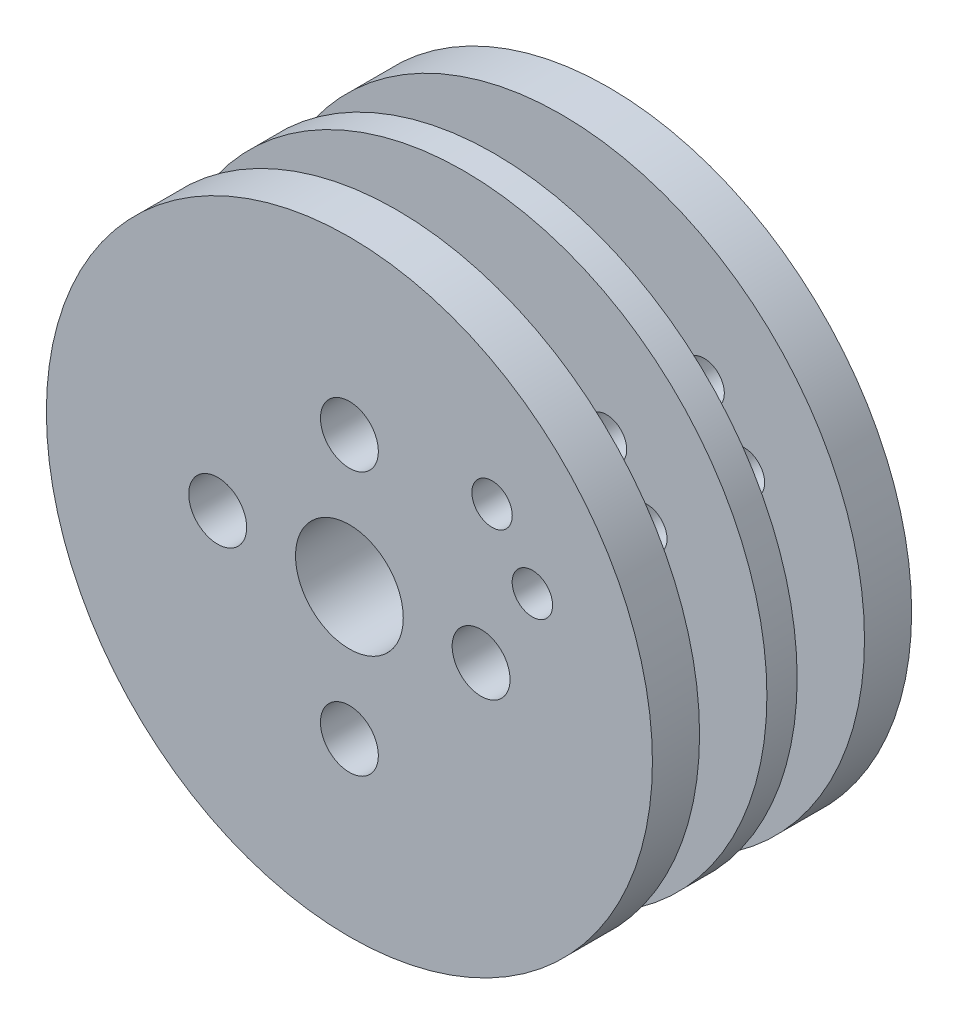
from build123d import *

# Parameters (mm, degrees)
SKETCH1_R           = 22.5
BOSS_EXTRUDE1_DEPTH = 2.24600008
SKETCH2_R           = 13
BOSS_EXTRUDE2_DEPTH = 5
BOSS_EXTRUDE4_START = 3.5
SKETCH5_R           = 22.5
BOSS_EXTRUDE4_DEPTH = 3.5
BOSS_EXTRUDE5_START = 5
SKETCH8_R           = 13
BOSS_EXTRUDE5_DEPTH = 5
SKETCH12_R          = 22.5
BOSS_EXTRUDE6_DEPTH = 3.5
SKETCH6_R           = 4
SKETCH6_R_2         = 2.15
SKETCH6_R_3         = 1.5
CUT_EXTRUDE1_DEPTH  = 38.187477988


with BuildPart() as part:
    # Sketch1 → Boss-Extrude1 (new body)
    with BuildSketch(Plane.XY):
        Circle(SKETCH1_R)
    extrude(amount=BOSS_EXTRUDE1_DEPTH)

    # Sketch2 → Boss-Extrude2 (add)
    with BuildSketch(Plane.XY):
        Circle(SKETCH2_R)
    extrude(amount=-BOSS_EXTRUDE2_DEPTH)

    # Sketch5 → Boss-Extrude4 (add)
    with BuildSketch(Plane(origin=(0, 0, -5), x_dir=(-1, 0, 0), z_dir=(0, 0, -1)).offset(BOSS_EXTRUDE4_START)):
        with Locations(Location((0, 0, 0), (0, 0, 180))):
            Circle(SKETCH5_R)
    extrude(amount=-BOSS_EXTRUDE4_DEPTH)

    # Sketch8 → Boss-Extrude5 (add)
    with BuildSketch(Plane.XY.offset(2.24600008).offset(BOSS_EXTRUDE5_START)):
        Circle(SKETCH8_R)
    extrude(amount=-BOSS_EXTRUDE5_DEPTH)

    # Sketch12 → Boss-Extrude6 (add)
    with BuildSketch(Plane.XY.offset(7.24600008)):
        Circle(SKETCH12_R)
    extrude(amount=BOSS_EXTRUDE6_DEPTH)

    # Sketch6 → Cut-Extrude1 (cut, through all)
    with BuildSketch(Plane.XY.offset(10.74600008)):
        Circle(SKETCH6_R)
        with Locations((0, 9.779)):
            Circle(SKETCH6_R_2)
        with Locations((9.779, 0)):
            Circle(SKETCH6_R_2)
        with Locations((0, -9.779)):
            Circle(SKETCH6_R_2)
        with Locations((-9.779, 0)):
            Circle(SKETCH6_R_2)
        with Locations((10.592506585, 10.620678145)):
            Circle(SKETCH6_R_3)
        with Locations((13.586186135, 6.35732226)):
            Circle(SKETCH6_R_3)
    extrude(amount=-CUT_EXTRUDE1_DEPTH, mode=Mode.SUBTRACT)


solid = part.part
